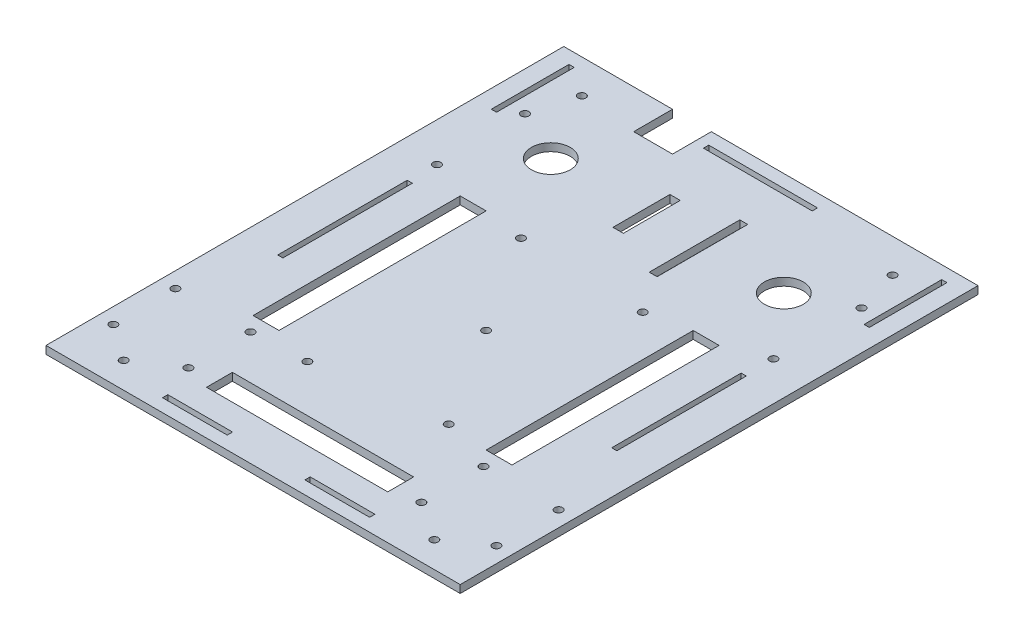
from build123d import *

# Parameters (mm, degrees)
SKETCH1_W           = 160
SKETCH1_H           = 200
BOSS_EXTRUDE1_DEPTH = 3
SKETCH2_R           = 1.5
SKETCH2_W           = 25
SKETCH2_H           = 2.05
SKETCH2_W_2         = 2
SKETCH2_H_2         = 50
SKETCH2_W_3         = 2.02
SKETCH2_H_3         = 30
SKETCH2_W_4         = 15
SKETCH2_H_4         = 15
SKETCH2_W_5         = 42
SKETCH2_W_6         = 4
SKETCH2_H_5         = 22
SKETCH2_W_7         = 3.05
SKETCH2_H_6         = 35
CUT_EXTRUDE1_DEPTH  = 3
SKETCH3_R           = 1.5
CUT_EXTRUDE2_DEPTH  = 129.097619025
SKETCH4_R           = 7.5
SKETCH4_R_2         = 1.5
SKETCH4_W           = 10
SKETCH4_H           = 80
SKETCH4_W_2         = 70
SKETCH4_H_2         = 10
CUT_EXTRUDE3_DEPTH  = 3
SKETCH5_R           = 1.5
CUT_EXTRUDE4_DEPTH  = 10


with BuildPart() as part:
    # Sketch1 → Boss-Extrude1 (new body)
    with BuildSketch(Plane(origin=(0, 0, 0), x_dir=(1, 0, 0), z_dir=(0, 1, 0))):
        Rectangle(SKETCH1_W, SKETCH1_H)
    extrude(amount=BOSS_EXTRUDE1_DEPTH)

    # Sketch2 → Cut-Extrude1 (cut)
    with BuildSketch(Plane(origin=(0, 3, 0), x_dir=(1, 0, 0), z_dir=(0, 1, 0))):
        with Locations(Location((-60, -90, 0), (0, 0, 270))):
            Circle(SKETCH2_R)
        with Locations(Location((60, -90, 0), (0, 0, 90))):
            Circle(SKETCH2_R)
        with Locations(Location((0, -10, 0), (0, 0, 270))):
            Circle(SKETCH2_R)
        with Locations(Location((-65, 70, 0), (0, 0, 270))):
            Circle(SKETCH2_R)
        with Locations(Location((65, 70, 0), (0, 0, 90))):
            Circle(SKETCH2_R)
        with Locations((27.5, -93.975)):
            Rectangle(SKETCH2_W, SKETCH2_H)
        with Locations((-27.5, -93.975)):
            Rectangle(SKETCH2_W, SKETCH2_H)
        with Locations((64.5, 0)):
            Rectangle(SKETCH2_W_2, SKETCH2_H_2)
        with Locations((-64.5, 0)):
            Rectangle(SKETCH2_W_2, SKETCH2_H_2)
        with Locations((71.99, 80)):
            Rectangle(SKETCH2_W_3, SKETCH2_H_3)
        with Locations((-30.5, 92.5)):
            Rectangle(SKETCH2_W_4, SKETCH2_H_4)
        with Locations((2, 93.975)):
            Rectangle(SKETCH2_W_5, SKETCH2_H)
        with Locations((-71.99, 80)):
            Rectangle(SKETCH2_W_3, SKETCH2_H_3)
        with Locations((-8, 60)):
            Rectangle(SKETCH2_W_6, SKETCH2_H_5)
        with Locations((13.525, 58.5)):
            Rectangle(SKETCH2_W_7, SKETCH2_H_6)
    extrude(amount=-CUT_EXTRUDE1_DEPTH, mode=Mode.SUBTRACT)

    # Sketch3 → Cut-Extrude2 (cut, through all)
    with BuildSketch(Plane(origin=(0, 3, 0), x_dir=(1, 0, 0), z_dir=(0, 1, 0))):
        with Locations(Location((-24.13, 27.6, 0), (0, 0, 270))):
            Circle(SKETCH3_R)
        with Locations(Location((24.13, 26.36, 0), (0, 0, 270))):
            Circle(SKETCH3_R)
        with Locations(Location((-24.13, -54.92, 0), (0, 0, 270))):
            Circle(SKETCH3_R)
        with Locations(Location((24.13, -48.57, 0), (0, 0, 270))):
            Circle(SKETCH3_R)
    extrude(amount=-CUT_EXTRUDE2_DEPTH, mode=Mode.SUBTRACT)

    # Sketch4 → Cut-Extrude3 (cut)
    with BuildSketch(Plane(origin=(0, 3, 0), x_dir=(1, 0, 0), z_dir=(0, 1, 0))):
        with Locations(Location((-45, 60, 0), (0, 0, 270))):
            Circle(SKETCH4_R)
        with Locations(Location((45, 60, 0), (0, 0, 90))):
            Circle(SKETCH4_R)
        with Locations(Location((-60, 87, 0), (0, 0, 270))):
            Circle(SKETCH4_R_2)
        with Locations(Location((60, 87, 0), (0, 0, 90))):
            Circle(SKETCH4_R_2)
        with Locations(Location((-65, 36, 0), (0, 0, 270))):
            Circle(SKETCH4_R_2)
        with Locations(Location((65, 36, 0), (0, 0, 90))):
            Circle(SKETCH4_R_2)
        with Locations((-45, -10)):
            Rectangle(SKETCH4_W, SKETCH4_H)
        with Locations((45, -10)):
            Rectangle(SKETCH4_W, SKETCH4_H)
        with Locations((0, -78)):
            Rectangle(SKETCH4_W_2, SKETCH4_H_2)
    extrude(amount=-CUT_EXTRUDE3_DEPTH, mode=Mode.SUBTRACT)

    # Sketch5 → Cut-Extrude4 (cut)
    with BuildSketch(Plane(origin=(0, 3, 0), x_dir=(1, 0, 0), z_dir=(0, 1, 0))):
        with Locations(Location((-74, -80, 0), (0, 0, 270))):
            Circle(SKETCH5_R)
        with Locations(Location((-74, -56, 0), (0, 0, 270))):
            Circle(SKETCH5_R)
        with Locations(Location((-45, -80, 0), (0, 0, 270))):
            Circle(SKETCH5_R)
        with Locations(Location((-45, -56, 0), (0, 0, 270))):
            Circle(SKETCH5_R)
        with Locations(Location((45, -80, 0), (0, 0, 270))):
            Circle(SKETCH5_R)
        with Locations(Location((45, -56, 0), (0, 0, 270))):
            Circle(SKETCH5_R)
        with Locations(Location((74, -80, 0), (0, 0, 270))):
            Circle(SKETCH5_R)
        with Locations(Location((74, -56, 0), (0, 0, 270))):
            Circle(SKETCH5_R)
    extrude(amount=-CUT_EXTRUDE4_DEPTH, mode=Mode.SUBTRACT)


solid = part.part
